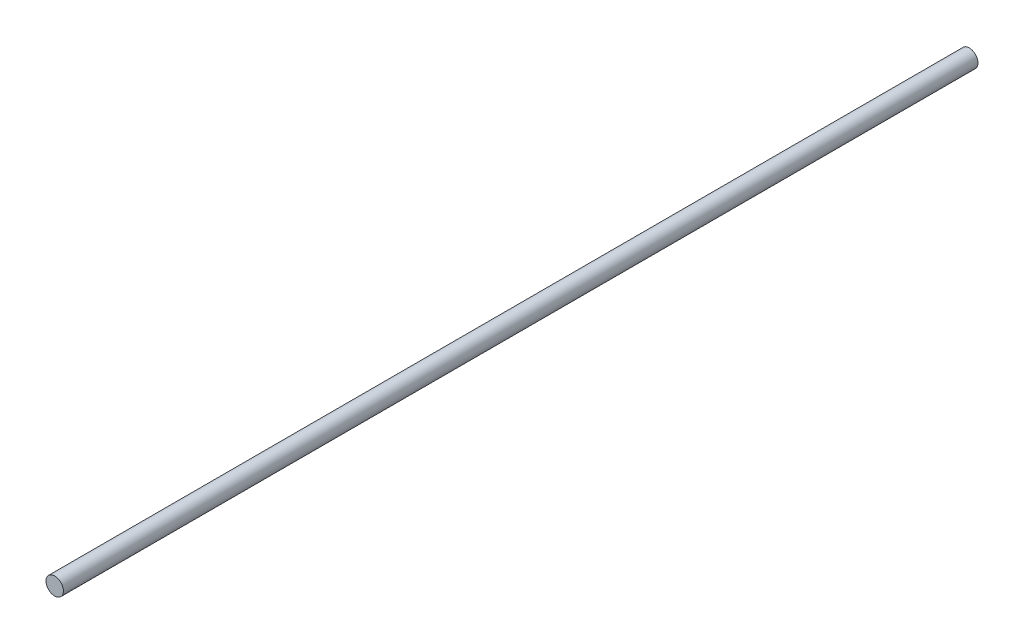
from build123d import *

# Parameters (mm, degrees)
SKETCH1_R           = 1
BOSS_EXTRUDE1_DEPTH = 105


with BuildPart() as part:
    # Sketch1 → Boss-Extrude1 (new body)
    with BuildSketch(Plane.XY):
        Circle(SKETCH1_R)
    extrude(amount=BOSS_EXTRUDE1_DEPTH)


solid = part.part
